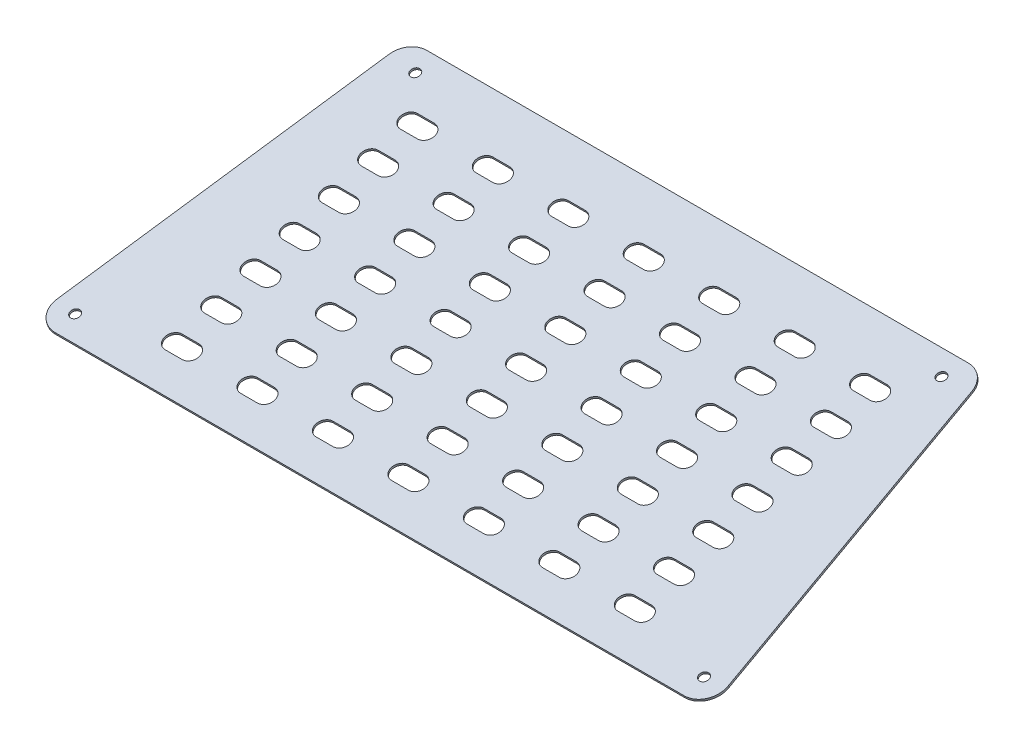
from build123d import *

# Parameters (mm, degrees)
BOSS_EXTRUDE1_START = 1
SKETCH2_R           = 2.25
BOSS_EXTRUDE1_DEPTH = 1
CUT_EXTRUDE1_DEPTH  = 1


with BuildPart() as part:
    # Sketch2 → Boss-Extrude1 (new body)
    with BuildSketch(Plane(origin=(0, 394.173712529, 122.85933897), x_dir=(1, 0, 0), z_dir=(0, 0.954700334487347, 0.2975689354246304)).offset(BOSS_EXTRUDE1_START)):
        with BuildLine():
            Line((-135.884853534, 895.817803129), (-156.770873577, 751.930272097))
            ThreePointArc((-156.770873577, 751.930272097), (-154.436497798, 743.95026563), (-146.874587609, 740.493774955))
            Line((-146.874587609, 740.493774955), (153.32268852, 740.493774955))
            ThreePointArc((153.32268852, 740.493774955), (160.884598709, 743.95026563), (163.218974488, 751.930272097))
            Line((163.218974488, 751.930272097), (142.332954445, 895.817803129))
            ThreePointArc((142.332954445, 895.817803129), (138.980177802, 901.943216176), (132.436668477, 904.381305987))
            Line((132.436668477, 904.381305987), (-125.988567566, 904.381305987))
            ThreePointArc((-125.988567566, 904.381305987), (-132.532076891, 901.943216176), (-135.884853534, 895.817803129))
        make_face()
        with Locations(Location((-122.305632525, 894.796162115, 0), (0, 0, 270))):
            Circle(SKETCH2_R, mode=Mode.SUBTRACT)
        with Locations(Location((128.753733436, 894.796162115, 0), (0, 0, 270))):
            Circle(SKETCH2_R, mode=Mode.SUBTRACT)
        with Locations(Location((153.224050456, 750.493774955, 0), (0, 0, 270))):
            Circle(SKETCH2_R, mode=Mode.SUBTRACT)
        with Locations(Location((-146.775949544, 750.493774955, 0), (0, 0, 270))):
            Circle(SKETCH2_R, mode=Mode.SUBTRACT)
    extrude(amount=BOSS_EXTRUDE1_DEPTH)

    # Sketch3 → Cut-Extrude1 (cut)
    with BuildSketch(Plane(origin=(0, 396.083113198, 123.454476841), x_dir=(1, 0, 0), z_dir=(0, 0.9547003344873469, 0.29756893542463037))):
        with BuildLine():
            Line((-108.849122671, 881.781305987), (-100.849122671, 881.781305987))
            ThreePointArc((-100.849122671, 881.781305987), (-96.649122671, 877.581305987), (-100.849122671, 873.381305987))
            Line((-100.849122671, 873.381305987), (-108.849122671, 873.381305987))
            ThreePointArc((-108.849122671, 873.381305987), (-113.049122671, 877.581305987), (-108.849122671, 881.781305987))
        make_face()
        with BuildLine():
            Line((-72.849122671, 881.781305987), (-64.849122671, 881.781305987))
            ThreePointArc((-64.849122671, 881.781305987), (-60.649122671, 877.581305987), (-64.849122671, 873.381305987))
            Line((-64.849122671, 873.381305987), (-72.849122671, 873.381305987))
            ThreePointArc((-72.849122671, 873.381305987), (-77.049122671, 877.581305987), (-72.849122671, 881.781305987))
        make_face()
        with BuildLine():
            Line((-36.849122671, 881.781305987), (-28.849122671, 881.781305987))
            ThreePointArc((-28.849122671, 881.781305987), (-24.649122671, 877.581305987), (-28.849122671, 873.381305987))
            Line((-28.849122671, 873.381305987), (-36.849122671, 873.381305987))
            ThreePointArc((-36.849122671, 873.381305987), (-41.049122671, 877.581305987), (-36.849122671, 881.781305987))
        make_face()
        with BuildLine():
            Line((-0.849122671, 881.781305987), (7.150877329, 881.781305987))
            ThreePointArc((7.150877329, 881.781305987), (11.350877329, 877.581305987), (7.150877329, 873.381305987))
            Line((7.150877329, 873.381305987), (-0.849122671, 873.381305987))
            ThreePointArc((-0.849122671, 873.381305987), (-5.049122671, 877.581305987), (-0.849122671, 881.781305987))
        make_face()
        with BuildLine():
            Line((35.150877329, 881.781305987), (43.150877329, 881.781305987))
            ThreePointArc((43.150877329, 881.781305987), (47.350877329, 877.581305987), (43.150877329, 873.381305987))
            Line((43.150877329, 873.381305987), (35.150877329, 873.381305987))
            ThreePointArc((35.150877329, 873.381305987), (30.950877329, 877.581305987), (35.150877329, 881.781305987))
        make_face()
        with BuildLine():
            Line((71.150877329, 881.781305987), (79.150877329, 881.781305987))
            ThreePointArc((79.150877329, 881.781305987), (83.350877329, 877.581305987), (79.150877329, 873.381305987))
            Line((79.150877329, 873.381305987), (71.150877329, 873.381305987))
            ThreePointArc((71.150877329, 873.381305987), (66.950877329, 877.581305987), (71.150877329, 881.781305987))
        make_face()
        with BuildLine():
            Line((107.150877329, 881.781305987), (115.150877329, 881.781305987))
            ThreePointArc((115.150877329, 881.781305987), (119.350877329, 877.581305987), (115.150877329, 873.381305987))
            Line((115.150877329, 873.381305987), (107.150877329, 873.381305987))
            ThreePointArc((107.150877329, 873.381305987), (102.950877329, 877.581305987), (107.150877329, 881.781305987))
        make_face()
        with BuildLine():
            Line((-72.849122671, 862.181305987), (-64.849122671, 862.181305987))
            ThreePointArc((-64.849122671, 862.181305987), (-60.649122671, 857.981305987), (-64.849122671, 853.781305987))
            Line((-64.849122671, 853.781305987), (-72.849122671, 853.781305987))
            ThreePointArc((-72.849122671, 853.781305987), (-77.049122671, 857.981305987), (-72.849122671, 862.181305987))
        make_face()
        with BuildLine():
            Line((-36.849122671, 862.181305987), (-28.849122671, 862.181305987))
            ThreePointArc((-28.849122671, 862.181305987), (-24.649122671, 857.981305987), (-28.849122671, 853.781305987))
            Line((-28.849122671, 853.781305987), (-36.849122671, 853.781305987))
            ThreePointArc((-36.849122671, 853.781305987), (-41.049122671, 857.981305987), (-36.849122671, 862.181305987))
        make_face()
        with BuildLine():
            Line((-0.849122671, 862.181305987), (7.150877329, 862.181305987))
            ThreePointArc((7.150877329, 862.181305987), (11.350877329, 857.981305987), (7.150877329, 853.781305987))
            Line((7.150877329, 853.781305987), (-0.849122671, 853.781305987))
            ThreePointArc((-0.849122671, 853.781305987), (-5.049122671, 857.981305987), (-0.849122671, 862.181305987))
        make_face()
        with BuildLine():
            Line((35.150877329, 862.181305987), (43.150877329, 862.181305987))
            ThreePointArc((43.150877329, 862.181305987), (47.350877329, 857.981305987), (43.150877329, 853.781305987))
            Line((43.150877329, 853.781305987), (35.150877329, 853.781305987))
            ThreePointArc((35.150877329, 853.781305987), (30.950877329, 857.981305987), (35.150877329, 862.181305987))
        make_face()
        with BuildLine():
            Line((71.150877329, 862.181305987), (79.150877329, 862.181305987))
            ThreePointArc((79.150877329, 862.181305987), (83.350877329, 857.981305987), (79.150877329, 853.781305987))
            Line((79.150877329, 853.781305987), (71.150877329, 853.781305987))
            ThreePointArc((71.150877329, 853.781305987), (66.950877329, 857.981305987), (71.150877329, 862.181305987))
        make_face()
        with BuildLine():
            Line((107.150877329, 862.181305987), (115.150877329, 862.181305987))
            ThreePointArc((115.150877329, 862.181305987), (119.350877329, 857.981305987), (115.150877329, 853.781305987))
            Line((115.150877329, 853.781305987), (107.150877329, 853.781305987))
            ThreePointArc((107.150877329, 853.781305987), (102.950877329, 857.981305987), (107.150877329, 862.181305987))
        make_face()
        with BuildLine():
            Line((-72.849122671, 842.581305987), (-64.849122671, 842.581305987))
            ThreePointArc((-64.849122671, 842.581305987), (-60.649122671, 838.381305987), (-64.849122671, 834.181305987))
            Line((-64.849122671, 834.181305987), (-72.849122671, 834.181305987))
            ThreePointArc((-72.849122671, 834.181305987), (-77.049122671, 838.381305987), (-72.849122671, 842.581305987))
        make_face()
        with BuildLine():
            Line((-36.849122671, 842.581305987), (-28.849122671, 842.581305987))
            ThreePointArc((-28.849122671, 842.581305987), (-24.649122671, 838.381305987), (-28.849122671, 834.181305987))
            Line((-28.849122671, 834.181305987), (-36.849122671, 834.181305987))
            ThreePointArc((-36.849122671, 834.181305987), (-41.049122671, 838.381305987), (-36.849122671, 842.581305987))
        make_face()
        with BuildLine():
            Line((-0.849122671, 842.581305987), (7.150877329, 842.581305987))
            ThreePointArc((7.150877329, 842.581305987), (11.350877329, 838.381305987), (7.150877329, 834.181305987))
            Line((7.150877329, 834.181305987), (-0.849122671, 834.181305987))
            ThreePointArc((-0.849122671, 834.181305987), (-5.049122671, 838.381305987), (-0.849122671, 842.581305987))
        make_face()
        with BuildLine():
            Line((35.150877329, 842.581305987), (43.150877329, 842.581305987))
            ThreePointArc((43.150877329, 842.581305987), (47.350877329, 838.381305987), (43.150877329, 834.181305987))
            Line((43.150877329, 834.181305987), (35.150877329, 834.181305987))
            ThreePointArc((35.150877329, 834.181305987), (30.950877329, 838.381305987), (35.150877329, 842.581305987))
        make_face()
        with BuildLine():
            Line((71.150877329, 842.581305987), (79.150877329, 842.581305987))
            ThreePointArc((79.150877329, 842.581305987), (83.350877329, 838.381305987), (79.150877329, 834.181305987))
            Line((79.150877329, 834.181305987), (71.150877329, 834.181305987))
            ThreePointArc((71.150877329, 834.181305987), (66.950877329, 838.381305987), (71.150877329, 842.581305987))
        make_face()
        with BuildLine():
            Line((107.150877329, 842.581305987), (115.150877329, 842.581305987))
            ThreePointArc((115.150877329, 842.581305987), (119.350877329, 838.381305987), (115.150877329, 834.181305987))
            Line((115.150877329, 834.181305987), (107.150877329, 834.181305987))
            ThreePointArc((107.150877329, 834.181305987), (102.950877329, 838.381305987), (107.150877329, 842.581305987))
        make_face()
        with BuildLine():
            Line((-72.849122671, 822.981305987), (-64.849122671, 822.981305987))
            ThreePointArc((-64.849122671, 822.981305987), (-60.649122671, 818.781305987), (-64.849122671, 814.581305987))
            Line((-64.849122671, 814.581305987), (-72.849122671, 814.581305987))
            ThreePointArc((-72.849122671, 814.581305987), (-77.049122671, 818.781305987), (-72.849122671, 822.981305987))
        make_face()
        with BuildLine():
            Line((-36.849122671, 822.981305987), (-28.849122671, 822.981305987))
            ThreePointArc((-28.849122671, 822.981305987), (-24.649122671, 818.781305987), (-28.849122671, 814.581305987))
            Line((-28.849122671, 814.581305987), (-36.849122671, 814.581305987))
            ThreePointArc((-36.849122671, 814.581305987), (-41.049122671, 818.781305987), (-36.849122671, 822.981305987))
        make_face()
        with BuildLine():
            Line((-0.849122671, 822.981305987), (7.150877329, 822.981305987))
            ThreePointArc((7.150877329, 822.981305987), (11.350877329, 818.781305987), (7.150877329, 814.581305987))
            Line((7.150877329, 814.581305987), (-0.849122671, 814.581305987))
            ThreePointArc((-0.849122671, 814.581305987), (-5.049122671, 818.781305987), (-0.849122671, 822.981305987))
        make_face()
        with BuildLine():
            Line((35.150877329, 822.981305987), (43.150877329, 822.981305987))
            ThreePointArc((43.150877329, 822.981305987), (47.350877329, 818.781305987), (43.150877329, 814.581305987))
            Line((43.150877329, 814.581305987), (35.150877329, 814.581305987))
            ThreePointArc((35.150877329, 814.581305987), (30.950877329, 818.781305987), (35.150877329, 822.981305987))
        make_face()
        with BuildLine():
            Line((71.150877329, 822.981305987), (79.150877329, 822.981305987))
            ThreePointArc((79.150877329, 822.981305987), (83.350877329, 818.781305987), (79.150877329, 814.581305987))
            Line((79.150877329, 814.581305987), (71.150877329, 814.581305987))
            ThreePointArc((71.150877329, 814.581305987), (66.950877329, 818.781305987), (71.150877329, 822.981305987))
        make_face()
        with BuildLine():
            Line((107.150877329, 822.981305987), (115.150877329, 822.981305987))
            ThreePointArc((115.150877329, 822.981305987), (119.350877329, 818.781305987), (115.150877329, 814.581305987))
            Line((115.150877329, 814.581305987), (107.150877329, 814.581305987))
            ThreePointArc((107.150877329, 814.581305987), (102.950877329, 818.781305987), (107.150877329, 822.981305987))
        make_face()
        with BuildLine():
            Line((-72.849122671, 803.381305987), (-64.849122671, 803.381305987))
            ThreePointArc((-64.849122671, 803.381305987), (-60.649122671, 799.181305987), (-64.849122671, 794.981305987))
            Line((-64.849122671, 794.981305987), (-72.849122671, 794.981305987))
            ThreePointArc((-72.849122671, 794.981305987), (-77.049122671, 799.181305987), (-72.849122671, 803.381305987))
        make_face()
        with BuildLine():
            Line((-36.849122671, 803.381305987), (-28.849122671, 803.381305987))
            ThreePointArc((-28.849122671, 803.381305987), (-24.649122671, 799.181305987), (-28.849122671, 794.981305987))
            Line((-28.849122671, 794.981305987), (-36.849122671, 794.981305987))
            ThreePointArc((-36.849122671, 794.981305987), (-41.049122671, 799.181305987), (-36.849122671, 803.381305987))
        make_face()
        with BuildLine():
            Line((-0.849122671, 803.381305987), (7.150877329, 803.381305987))
            ThreePointArc((7.150877329, 803.381305987), (11.350877329, 799.181305987), (7.150877329, 794.981305987))
            Line((7.150877329, 794.981305987), (-0.849122671, 794.981305987))
            ThreePointArc((-0.849122671, 794.981305987), (-5.049122671, 799.181305987), (-0.849122671, 803.381305987))
        make_face()
        with BuildLine():
            Line((35.150877329, 803.381305987), (43.150877329, 803.381305987))
            ThreePointArc((43.150877329, 803.381305987), (47.350877329, 799.181305987), (43.150877329, 794.981305987))
            Line((43.150877329, 794.981305987), (35.150877329, 794.981305987))
            ThreePointArc((35.150877329, 794.981305987), (30.950877329, 799.181305987), (35.150877329, 803.381305987))
        make_face()
        with BuildLine():
            Line((71.150877329, 803.381305987), (79.150877329, 803.381305987))
            ThreePointArc((79.150877329, 803.381305987), (83.350877329, 799.181305987), (79.150877329, 794.981305987))
            Line((79.150877329, 794.981305987), (71.150877329, 794.981305987))
            ThreePointArc((71.150877329, 794.981305987), (66.950877329, 799.181305987), (71.150877329, 803.381305987))
        make_face()
        with BuildLine():
            Line((107.150877329, 803.381305987), (115.150877329, 803.381305987))
            ThreePointArc((115.150877329, 803.381305987), (119.350877329, 799.181305987), (115.150877329, 794.981305987))
            Line((115.150877329, 794.981305987), (107.150877329, 794.981305987))
            ThreePointArc((107.150877329, 794.981305987), (102.950877329, 799.181305987), (107.150877329, 803.381305987))
        make_face()
        with BuildLine():
            Line((-72.849122671, 783.781305987), (-64.849122671, 783.781305987))
            ThreePointArc((-64.849122671, 783.781305987), (-60.649122671, 779.581305987), (-64.849122671, 775.381305987))
            Line((-64.849122671, 775.381305987), (-72.849122671, 775.381305987))
            ThreePointArc((-72.849122671, 775.381305987), (-77.049122671, 779.581305987), (-72.849122671, 783.781305987))
        make_face()
        with BuildLine():
            Line((-36.849122671, 783.781305987), (-28.849122671, 783.781305987))
            ThreePointArc((-28.849122671, 783.781305987), (-24.649122671, 779.581305987), (-28.849122671, 775.381305987))
            Line((-28.849122671, 775.381305987), (-36.849122671, 775.381305987))
            ThreePointArc((-36.849122671, 775.381305987), (-41.049122671, 779.581305987), (-36.849122671, 783.781305987))
        make_face()
        with BuildLine():
            Line((-0.849122671, 783.781305987), (7.150877329, 783.781305987))
            ThreePointArc((7.150877329, 783.781305987), (11.350877329, 779.581305987), (7.150877329, 775.381305987))
            Line((7.150877329, 775.381305987), (-0.849122671, 775.381305987))
            ThreePointArc((-0.849122671, 775.381305987), (-5.049122671, 779.581305987), (-0.849122671, 783.781305987))
        make_face()
        with BuildLine():
            Line((35.150877329, 783.781305987), (43.150877329, 783.781305987))
            ThreePointArc((43.150877329, 783.781305987), (47.350877329, 779.581305987), (43.150877329, 775.381305987))
            Line((43.150877329, 775.381305987), (35.150877329, 775.381305987))
            ThreePointArc((35.150877329, 775.381305987), (30.950877329, 779.581305987), (35.150877329, 783.781305987))
        make_face()
        with BuildLine():
            Line((71.150877329, 783.781305987), (79.150877329, 783.781305987))
            ThreePointArc((79.150877329, 783.781305987), (83.350877329, 779.581305987), (79.150877329, 775.381305987))
            Line((79.150877329, 775.381305987), (71.150877329, 775.381305987))
            ThreePointArc((71.150877329, 775.381305987), (66.950877329, 779.581305987), (71.150877329, 783.781305987))
        make_face()
        with BuildLine():
            Line((107.150877329, 783.781305987), (115.150877329, 783.781305987))
            ThreePointArc((115.150877329, 783.781305987), (119.350877329, 779.581305987), (115.150877329, 775.381305987))
            Line((115.150877329, 775.381305987), (107.150877329, 775.381305987))
            ThreePointArc((107.150877329, 775.381305987), (102.950877329, 779.581305987), (107.150877329, 783.781305987))
        make_face()
        with BuildLine():
            Line((-72.849122671, 764.181305987), (-64.849122671, 764.181305987))
            ThreePointArc((-64.849122671, 764.181305987), (-60.649122671, 759.981305987), (-64.849122671, 755.781305987))
            Line((-64.849122671, 755.781305987), (-72.849122671, 755.781305987))
            ThreePointArc((-72.849122671, 755.781305987), (-77.049122671, 759.981305987), (-72.849122671, 764.181305987))
        make_face()
        with BuildLine():
            Line((-36.849122671, 764.181305987), (-28.849122671, 764.181305987))
            ThreePointArc((-28.849122671, 764.181305987), (-24.649122671, 759.981305987), (-28.849122671, 755.781305987))
            Line((-28.849122671, 755.781305987), (-36.849122671, 755.781305987))
            ThreePointArc((-36.849122671, 755.781305987), (-41.049122671, 759.981305987), (-36.849122671, 764.181305987))
        make_face()
        with BuildLine():
            Line((-0.849122671, 764.181305987), (7.150877329, 764.181305987))
            ThreePointArc((7.150877329, 764.181305987), (11.350877329, 759.981305987), (7.150877329, 755.781305987))
            Line((7.150877329, 755.781305987), (-0.849122671, 755.781305987))
            ThreePointArc((-0.849122671, 755.781305987), (-5.049122671, 759.981305987), (-0.849122671, 764.181305987))
        make_face()
        with BuildLine():
            Line((35.150877329, 764.181305987), (43.150877329, 764.181305987))
            ThreePointArc((43.150877329, 764.181305987), (47.350877329, 759.981305987), (43.150877329, 755.781305987))
            Line((43.150877329, 755.781305987), (35.150877329, 755.781305987))
            ThreePointArc((35.150877329, 755.781305987), (30.950877329, 759.981305987), (35.150877329, 764.181305987))
        make_face()
        with BuildLine():
            Line((71.150877329, 764.181305987), (79.150877329, 764.181305987))
            ThreePointArc((79.150877329, 764.181305987), (83.350877329, 759.981305987), (79.150877329, 755.781305987))
            Line((79.150877329, 755.781305987), (71.150877329, 755.781305987))
            ThreePointArc((71.150877329, 755.781305987), (66.950877329, 759.981305987), (71.150877329, 764.181305987))
        make_face()
        with BuildLine():
            Line((107.150877329, 764.181305987), (115.150877329, 764.181305987))
            ThreePointArc((115.150877329, 764.181305987), (119.350877329, 759.981305987), (115.150877329, 755.781305987))
            Line((115.150877329, 755.781305987), (107.150877329, 755.781305987))
            ThreePointArc((107.150877329, 755.781305987), (102.950877329, 759.981305987), (107.150877329, 764.181305987))
        make_face()
        with BuildLine():
            Line((-108.849122671, 862.181305987), (-100.849122671, 862.181305987))
            ThreePointArc((-100.849122671, 862.181305987), (-96.649122671, 857.981305987), (-100.849122671, 853.781305987))
            Line((-100.849122671, 853.781305987), (-108.849122671, 853.781305987))
            ThreePointArc((-108.849122671, 853.781305987), (-113.049122671, 857.981305987), (-108.849122671, 862.181305987))
        make_face()
        with BuildLine():
            Line((-108.849122671, 842.581305987), (-100.849122671, 842.581305987))
            ThreePointArc((-100.849122671, 842.581305987), (-96.649122671, 838.381305987), (-100.849122671, 834.181305987))
            Line((-100.849122671, 834.181305987), (-108.849122671, 834.181305987))
            ThreePointArc((-108.849122671, 834.181305987), (-113.049122671, 838.381305987), (-108.849122671, 842.581305987))
        make_face()
        with BuildLine():
            Line((-108.849122671, 822.981305987), (-100.849122671, 822.981305987))
            ThreePointArc((-100.849122671, 822.981305987), (-96.649122671, 818.781305987), (-100.849122671, 814.581305987))
            Line((-100.849122671, 814.581305987), (-108.849122671, 814.581305987))
            ThreePointArc((-108.849122671, 814.581305987), (-113.049122671, 818.781305987), (-108.849122671, 822.981305987))
        make_face()
        with BuildLine():
            Line((-108.849122671, 803.381305987), (-100.849122671, 803.381305987))
            ThreePointArc((-100.849122671, 803.381305987), (-96.649122671, 799.181305987), (-100.849122671, 794.981305987))
            Line((-100.849122671, 794.981305987), (-108.849122671, 794.981305987))
            ThreePointArc((-108.849122671, 794.981305987), (-113.049122671, 799.181305987), (-108.849122671, 803.381305987))
        make_face()
        with BuildLine():
            Line((-108.849122671, 783.781305987), (-100.849122671, 783.781305987))
            ThreePointArc((-100.849122671, 783.781305987), (-96.649122671, 779.581305987), (-100.849122671, 775.381305987))
            Line((-100.849122671, 775.381305987), (-108.849122671, 775.381305987))
            ThreePointArc((-108.849122671, 775.381305987), (-113.049122671, 779.581305987), (-108.849122671, 783.781305987))
        make_face()
        with BuildLine():
            Line((-108.849122671, 764.181305987), (-100.849122671, 764.181305987))
            ThreePointArc((-100.849122671, 764.181305987), (-96.649122671, 759.981305987), (-100.849122671, 755.781305987))
            Line((-100.849122671, 755.781305987), (-108.849122671, 755.781305987))
            ThreePointArc((-108.849122671, 755.781305987), (-113.049122671, 759.981305987), (-108.849122671, 764.181305987))
        make_face()
    extrude(amount=-CUT_EXTRUDE1_DEPTH, mode=Mode.SUBTRACT)


solid = part.part
